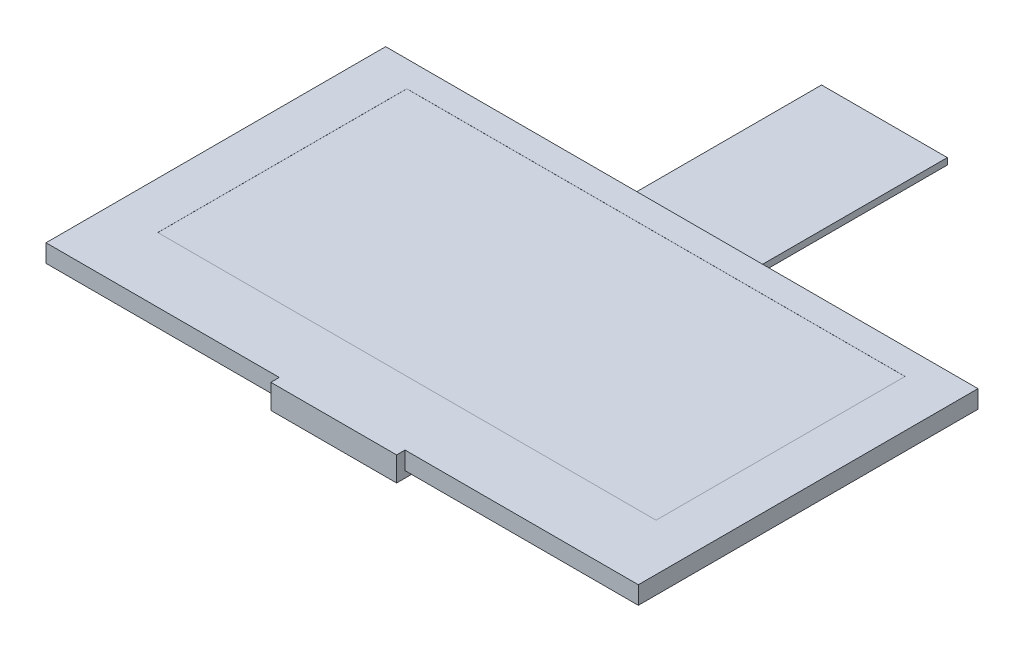
from build123d import *

# Parameters (mm, degrees)
SKETCH_1_W          = 73
SKETCH_1_H          = 41.86
EXTRUDE_1_DEPTH     = 2.2
SKETCH_2_W          = 61.41
SKETCH_2_H          = 30.69
CUT_EXTRUDE_1_DEPTH = 0.01
SKETCH_3_W          = 15.5
SKETCH_3_H          = 2.08
EXTRUDE_2_DEPTH     = 3
EXTRUDE_START       = -3
SKETCH_3_3_W        = 15.5
SKETCH_3_3_H        = 24.97
SKETCH_3_3_H_2      = 2.08
EXTRUDE_3_DEPTH     = 0.8


with BuildPart() as part:
    # 草图1 → 凸台-拉伸1 (new body)
    with BuildSketch(Plane(origin=(0, 0, 0), x_dir=(1, 0, 0), z_dir=(0, 1, 0))):
        Rectangle(SKETCH_1_W, SKETCH_1_H)
    extrude(amount=EXTRUDE_1_DEPTH)

    # 草图2 → 切除-拉伸1 (cut)
    with BuildSketch(Plane(origin=(0, 2.2, 0), x_dir=(1, 0, 0), z_dir=(0, 1, 0))):
        with Locations((0, 2.395)):
            Rectangle(SKETCH_2_W, SKETCH_2_H)
    extrude(amount=-CUT_EXTRUDE_1_DEPTH, mode=Mode.SUBTRACT)

    # 草图3 → 凸台-拉伸2 (add)
    with BuildSketch(Plane(origin=(0, 2.2, 0), x_dir=(1, 0, 0), z_dir=(0, 1, 0))):
        with Locations((0, -20.93)):
            Rectangle(SKETCH_3_W, SKETCH_3_H)
    extrude(amount=-EXTRUDE_2_DEPTH)

    # 草图3<3> → 凸台-拉伸3 (add)
    with BuildSketch(Plane(origin=(0, 2.2, 0), x_dir=(1, 0, 0), z_dir=(0, 1, 0)).offset(EXTRUDE_START)):
        with Locations((0, 33.415)):
            Rectangle(SKETCH_3_3_W, SKETCH_3_3_H)
        with Locations((0, -20.93)):
            Rectangle(SKETCH_3_3_W, SKETCH_3_3_H_2)
    extrude(amount=EXTRUDE_3_DEPTH)


with BuildPart() as extrude_3_piece_1:
    # of the separate pieces the step leaves, piece 1, a body of its own (extrude_3_pieces)
    add(part.part.solids().sort_by_distance((-36.5, 0, 20.93))[0])


with BuildPart() as extrude_3_piece_2:
    # of the separate pieces the step leaves, piece 2, a body of its own (extrude_3_pieces)
    add(part.part.solids().sort_by_distance((-7.75, -0.8, -20.93))[0])


solid = Compound([extrude_3_piece_1.part, extrude_3_piece_2.part])
